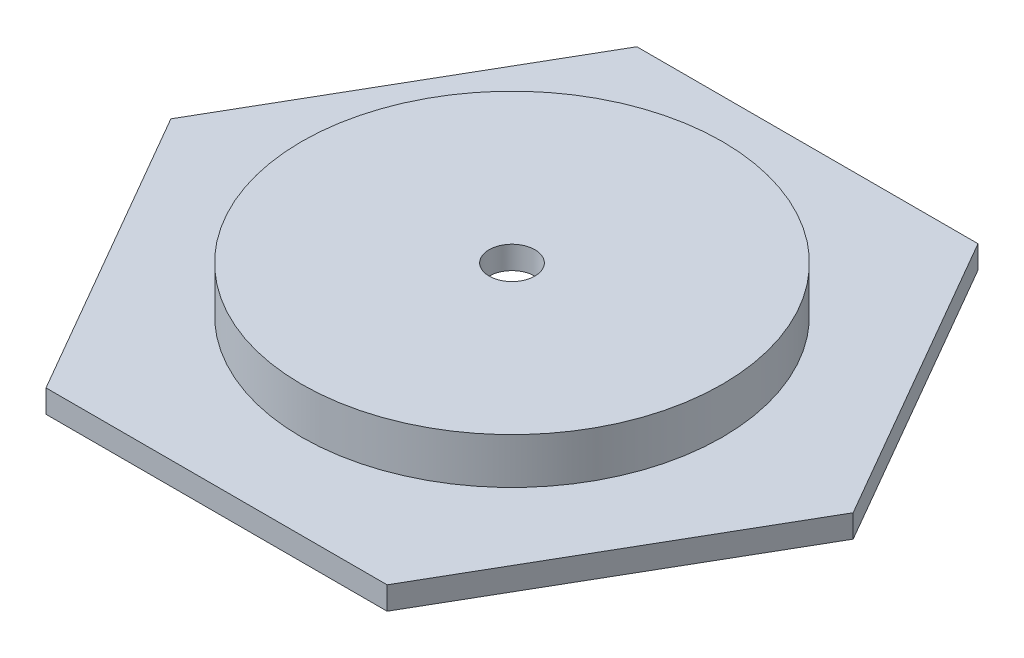
from build123d import *

# Parameters (mm, degrees)
BOSS_EXTRUDE1_DEPTH = 2.5
SKETCH3_R           = 2.5
CUT_EXTRUDE1_DEPTH  = 2.5
SKETCH4_R           = 22.966828386
BOSS_EXTRUDE2_DEPTH = 5
SKETCH5_R           = 20.826616742
CUT_EXTRUDE2_DEPTH  = 5
SKETCH6_R           = 2.5
CUT_EXTRUDE3_DEPTH  = 5


with BuildPart() as part:
    # Sketch2 → Boss-Extrude1 (new body)
    with BuildSketch(Plane(origin=(0, 0, 0), x_dir=(1, 0, 0), z_dir=(0, 1, 0))):
        Polygon((37.25, 0), (18.625, 32.259446291), (-18.625, 32.259446291), (-37.25, 0), (-18.625, -32.259446291), (18.625, -32.259446291), align=None)
    extrude(amount=BOSS_EXTRUDE1_DEPTH)

    # Sketch3 → Cut-Extrude1 (cut)
    with BuildSketch(Plane.XZ):
        with Locations(Location((0, 0, 0), (0, 0, 270))):
            Circle(SKETCH3_R)
    extrude(amount=-CUT_EXTRUDE1_DEPTH, mode=Mode.SUBTRACT)

    # Sketch4 → Boss-Extrude2 (add)
    with BuildSketch(Plane(origin=(0, 2.5, 0), x_dir=(1, 0, 0), z_dir=(0, 1, 0))):
        with Locations(Location((0, 0, 0), (0, 0, 270))):
            Circle(SKETCH4_R)
    extrude(amount=BOSS_EXTRUDE2_DEPTH)

    # Sketch5 → Cut-Extrude2 (cut)
    with BuildSketch(Plane.XZ):
        with Locations(Location((0, 0, 0), (0, 0, 270))):
            Circle(SKETCH5_R)
    extrude(amount=-CUT_EXTRUDE2_DEPTH, mode=Mode.SUBTRACT)

    # Sketch6 → Cut-Extrude3 (cut)
    with BuildSketch(Plane.XZ.offset(-5)):
        with Locations(Location((0, 0, 0), (0, 0, 270))):
            Circle(SKETCH6_R)
    extrude(amount=-CUT_EXTRUDE3_DEPTH, mode=Mode.SUBTRACT)


solid = part.part
